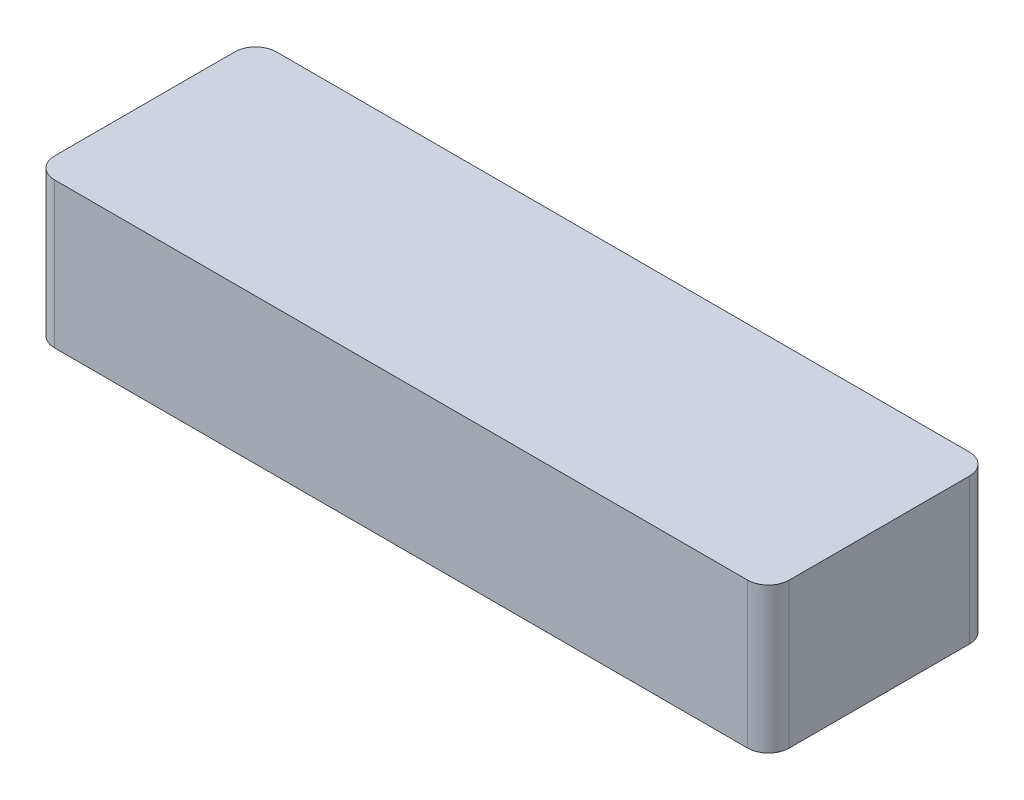
from build123d import *

# Parameters (mm, degrees)
SKETCH1_W           = 106
SKETCH1_H           = 21
BOSS_EXTRUDE1_DEPTH = 32
FILLET1_R           = 3


with BuildPart() as part:
    # Sketch1 → Boss-Extrude1 (new body)
    with BuildSketch(Plane.XY):
        with Locations((-31.059248555, -1.365606936)):
            Rectangle(SKETCH1_W, SKETCH1_H)
    extrude(amount=BOSS_EXTRUDE1_DEPTH)

    # Fillet1
    fillet1_edges = [part.edges().sort_by_distance(p)[0] for p in [
        (21.940751445, -1.365606936, 32),
        (-84.059248555, -1.365606936, 32),
        (21.940751445, -1.365606936, 0),
        (-84.059248555, -1.365606936, 0),
    ]]
    fillet(fillet1_edges, radius=FILLET1_R)


solid = part.part
